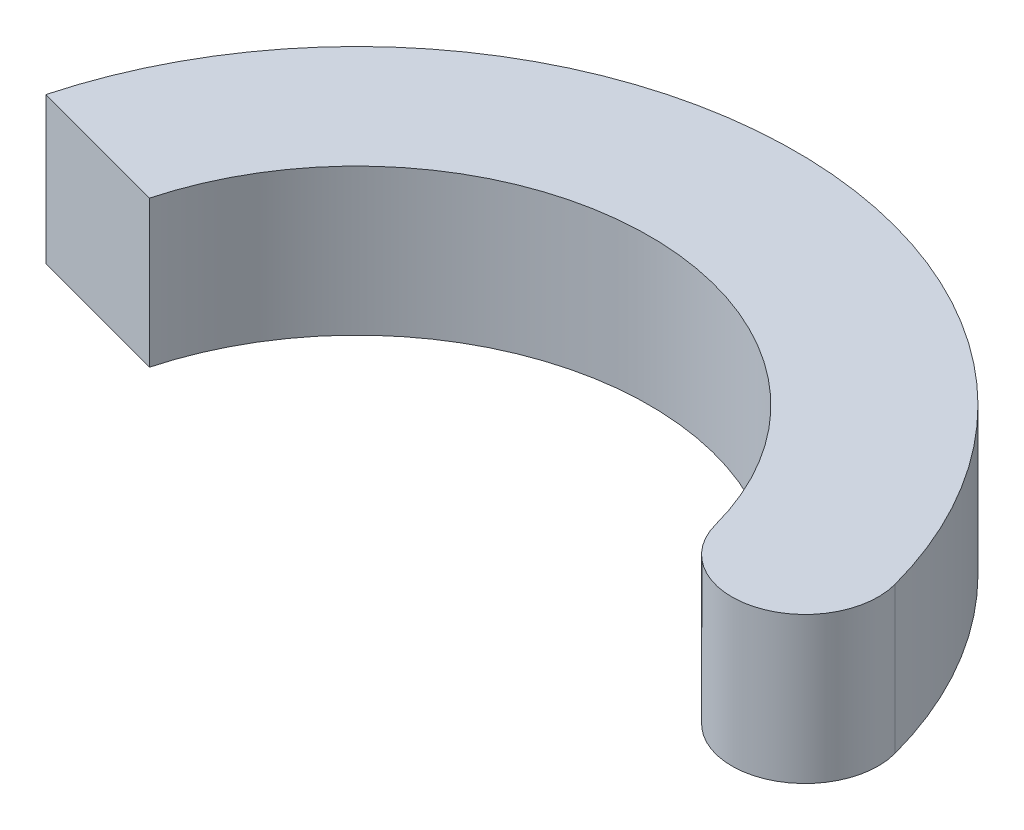
from build123d import *

# Parameters (mm, degrees)
BOSS_EXTRUDE1_DEPTH = 20


with BuildPart() as part:
    # Sketch2 → Boss-Extrude1 (new body)
    with BuildSketch(Plane(origin=(0, 0, 0), x_dir=(1, 0, 0), z_dir=(0, 1, 0))):
        with BuildLine():
            Line((-57.955549577, 15.529142706), (-38.637033052, 10.352761804))
            ThreePointArc((-38.637033052, 10.352761804), (0, 40), (38.637033052, 10.352761804))
            ThreePointArc((38.637033052, 10.352761804), (50.884481765, 3.281693992), (57.955549577, 15.529142706))
            ThreePointArc((57.955549577, 15.529142706), (0, 60), (-57.955549577, 15.529142706))
        make_face()
    extrude(amount=BOSS_EXTRUDE1_DEPTH)


solid = part.part
